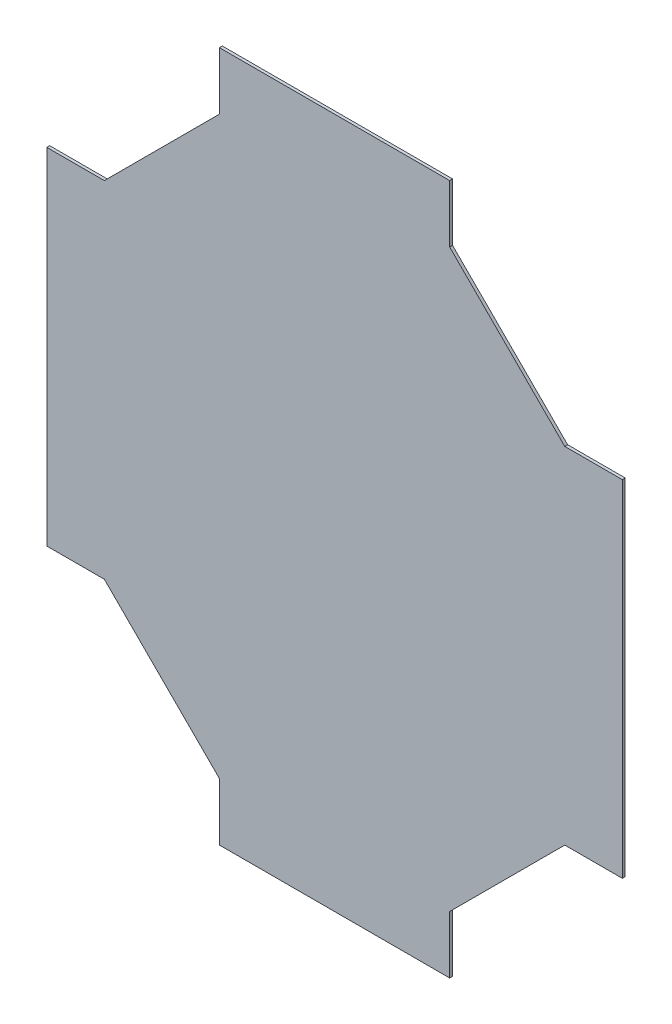
from build123d import *

# Parameters (mm, degrees)
SKETCH1_W           = 635
SKETCH1_H           = 762
BOSS_EXTRUDE1_DEPTH = 3.175
SKETCH3_W           = 901.746898996
SKETCH3_H           = 1073.20581641
CUT_EXTRUDE1_DEPTH  = 496.961017243


with BuildPart() as part:
    # Sketch1 → Boss-Extrude1 (new body)
    with BuildSketch(Plane.XY):
        Rectangle(SKETCH1_W, SKETCH1_H)
    extrude(amount=BOSS_EXTRUDE1_DEPTH)

    # Sketch3 → Cut-Extrude1 (cut, through all)
    with BuildSketch(Plane.XY.offset(3.175)):
        with Locations((-17.044225779, -39.145238765)):
            Rectangle(SKETCH3_W, SKETCH3_H)
        Polygon((-127, 381), (127, 381), (127, 317.5), (254, 190.5), (317.5, 190.5), (317.5, -190.5), (254, -190.5), (127, -317.5), (127, -381), (-127, -381), (-127, -317.5), (-254, -190.5), (-317.5, -190.5), (-317.5, 190.5), (-254, 190.5), (-127, 317.5), align=None, mode=Mode.SUBTRACT)
    extrude(amount=-CUT_EXTRUDE1_DEPTH, mode=Mode.SUBTRACT)


solid = part.part
